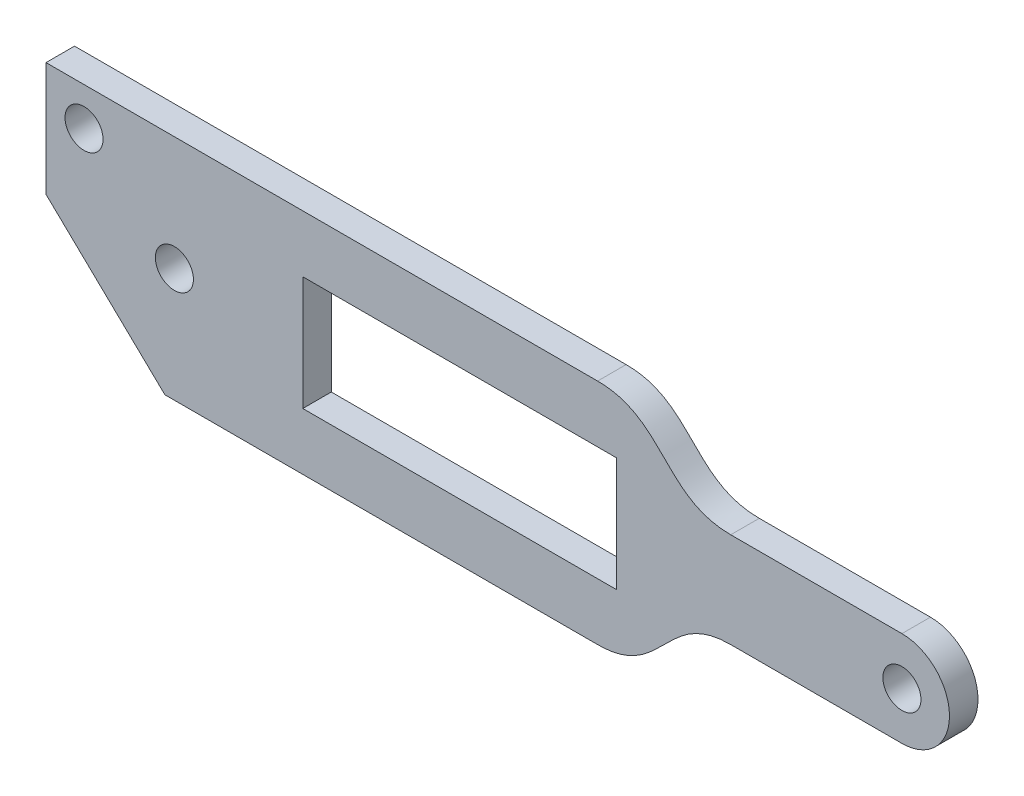
from build123d import *

# Parameters (mm, degrees)
ESQUISSE1_R        = 2
ESQUISSE1_W        = 33
ESQUISSE1_H        = 12
BOSS_EXTRU_1_DEPTH = 3


with BuildPart() as part:
    # Esquisse1 → Boss.-Extru.1 (new body)
    with BuildSketch(Plane.XY):
        with BuildLine():
            Line((-47.5, 12), (-47.5, 0))
            Line((-47.5, 0), (-35, -12))
            Line((-35, -12), (10.5, -12))
            add(Edge.make_bspline(
                [(10.5, -12), (17.5, -12), (17.5, -5), (24.5, -5)],
                knots=[0.5, 0.5, 0.5, 0.5, 1.5, 1.5, 1.5, 1.5], degree=3))
            Line((24.5, -5), (42.5, -5))
            ThreePointArc((42.5, -5), (47.5, 0), (42.5, 5))
            Line((42.5, 5), (24.5, 5))
            add(Edge.make_bspline(
                [(24.5, 5), (17.5, 5), (17.5, 12), (10.5, 12)],
                knots=[0, 0, 0, 0, 1, 1, 1, 1], degree=3))
            Line((10.5, 12), (-47.5, 12))
        make_face()
        with Locations((-34, 0)):
            Circle(ESQUISSE1_R, mode=Mode.SUBTRACT)
        with Locations((-4, 0)):
            Rectangle(ESQUISSE1_W, ESQUISSE1_H, mode=Mode.SUBTRACT)
        with Locations((-43.5, 8)):
            Circle(ESQUISSE1_R, mode=Mode.SUBTRACT)
        with Locations((42.5, 0)):
            Circle(ESQUISSE1_R, mode=Mode.SUBTRACT)
    extrude(amount=BOSS_EXTRU_1_DEPTH)


solid = part.part
